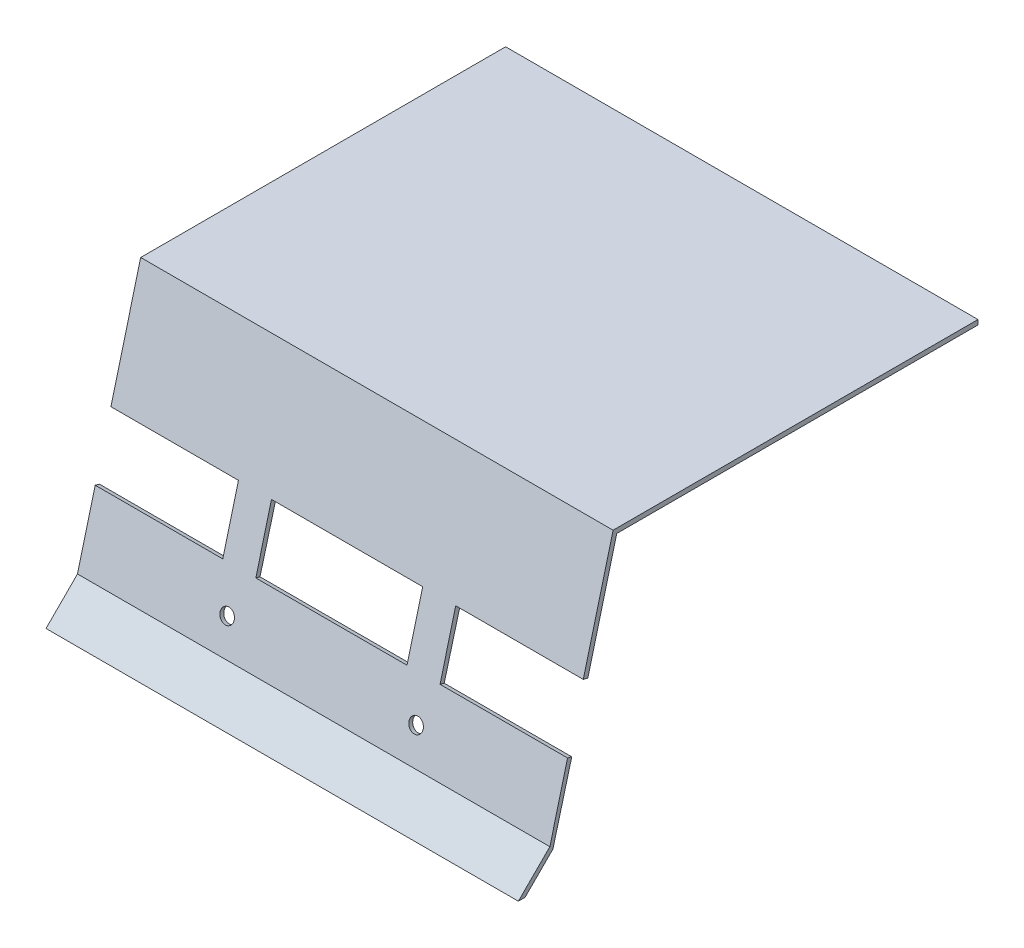
from build123d import *

# Parameters (mm, degrees)
RESSALTO_EXTRUS_O1_DEPTH = 100
RESSALTO_EXTRUS_O2_DEPTH = 100
CORTE_EXTRUS_O1_DEPTH    = 100
RESSALTO_EXTRUS_O3_DEPTH = 100
ESBO_O20_R               = 1.5
CORTE_EXTRUS_O6_DEPTH    = 5
ESBO_O24_W               = 27
ESBO_O24_H               = 13.16698281
ESBO_O24_W_2             = 32
CORTE_EXTRUS_O7_DEPTH    = 115.152987189
CORTE_EXTRUS_O8_DEPTH    = 115.291627571
RESSALTO_EXTRUS_O4_DEPTH = 100


with BuildPart() as part:
    # Esboço1 → Ressalto-extrusão1 (new body)
    with BuildSketch(Plane(origin=(0, 0, 0), x_dir=(0, 0, -1), z_dir=(1, 0, 0))):
        Polygon((0, 0), (9.292893219, 9.292893219), (15.968885233, 32.111148665), (16.934326675, 31.850528592), (10, 8.585786438), (1.414213562, 0), align=None)
    extrude(amount=RESSALTO_EXTRUS_O1_DEPTH)

    # Esboço2 → Ressalto-extrusão2 (add)
    with BuildSketch(Plane(origin=(100, 0, 0), x_dir=(0, 0, -1), z_dir=(1, 0, 0))):
        Polygon((7.816147842, 7.816147842), (14.517472223, 32.825830908), (13.549802648, 33.078052229), (6.665390157, 6.665390157), align=None)
    extrude(amount=-RESSALTO_EXTRUS_O2_DEPTH)

    # Esboço3 → Corte-extrusão1 (cut)
    with BuildSketch(Plane(origin=(100, 0, 0), x_dir=(0, 0, -1), z_dir=(1, 0, 0))):
        Polygon((7.298509752, 5.88429619), (7.816147842, 7.816147842), (9.292893219, 9.292893219), (15.968885233, 32.111148665), (16.934326675, 31.850528592), (10, 8.585786438), align=None)
    extrude(amount=-CORTE_EXTRUS_O1_DEPTH, mode=Mode.SUBTRACT)

    # Esboço4 → Ressalto-extrusão3 (add)
    with BuildSketch(Plane(origin=(100, 0, 0), x_dir=(0, 0, -1), z_dir=(1, 0, 0))):
        Polygon((13.549802648, 33.078052229), (14.517472223, 32.825830908), (19.404372889, 51.574860843), (18.436703315, 51.827082163), align=None)
    extrude(amount=-RESSALTO_EXTRUS_O3_DEPTH)

    # Esboço20 → Corte-extrusão6 (cut)
    with BuildSketch(Plane(origin=(0, -1.202778341, -4.614566301), x_dir=(1, 0, 0), z_dir=(0, 0.25222132052248, 0.9676695745314599))):
        with Locations(Location((30, 14.801620202, 0), (0, 0, 270))):
            Circle(ESBO_O20_R)
        with Locations(Location((70, 14.801620202, 0), (0, 0, 270))):
            Circle(ESBO_O20_R)
    extrude(amount=-CORTE_EXTRUS_O6_DEPTH, mode=Mode.SUBTRACT)

    # Esboço24 → Corte-extrusão7 (cut, through all)
    with BuildSketch(Plane(origin=(0, -1.202778341, -4.614566301), x_dir=(1, 0, 0), z_dir=(0, 0.25222132052248, 0.9676695745314599))):
        with Locations((13.5, 29.585111607)):
            Rectangle(ESBO_O24_W, ESBO_O24_H)
        with Locations((86.5, 29.585111607)):
            Rectangle(ESBO_O24_W, ESBO_O24_H)
        with Locations((50, 29.585111607)):
            Rectangle(ESBO_O24_W_2, ESBO_O24_H)
    extrude(amount=-CORTE_EXTRUS_O7_DEPTH, mode=Mode.SUBTRACT)

    # Esboço25 → Corte-extrusão8 (cut, through all)
    with BuildSketch(Plane(origin=(100, 0, 0), x_dir=(0, 0, -1), z_dir=(1, 0, 0))):
        Polygon((17.579835578, 44.574860843), (10.547206245, 44.574860843), (18.436703315, 51.827082163), (19.404372889, 51.574860843), align=None)
    extrude(amount=-CORTE_EXTRUS_O8_DEPTH, mode=Mode.SUBTRACT)

    # Esboço26 → Ressalto-extrusão4 (add)
    with BuildSketch(Plane(origin=(100, 0, 0), x_dir=(0, 0, -1), z_dir=(1, 0, 0))):
        Polygon((16.546424974, 44.574860843), (17.579835578, 44.574860843), (20.818425576, 57), (63.298509752, 57), (97.298509752, 57), (97.298509752, 58), (63.298509752, 58), (20.045663159, 58), align=None)
    extrude(amount=-RESSALTO_EXTRUS_O4_DEPTH)


solid = part.part
